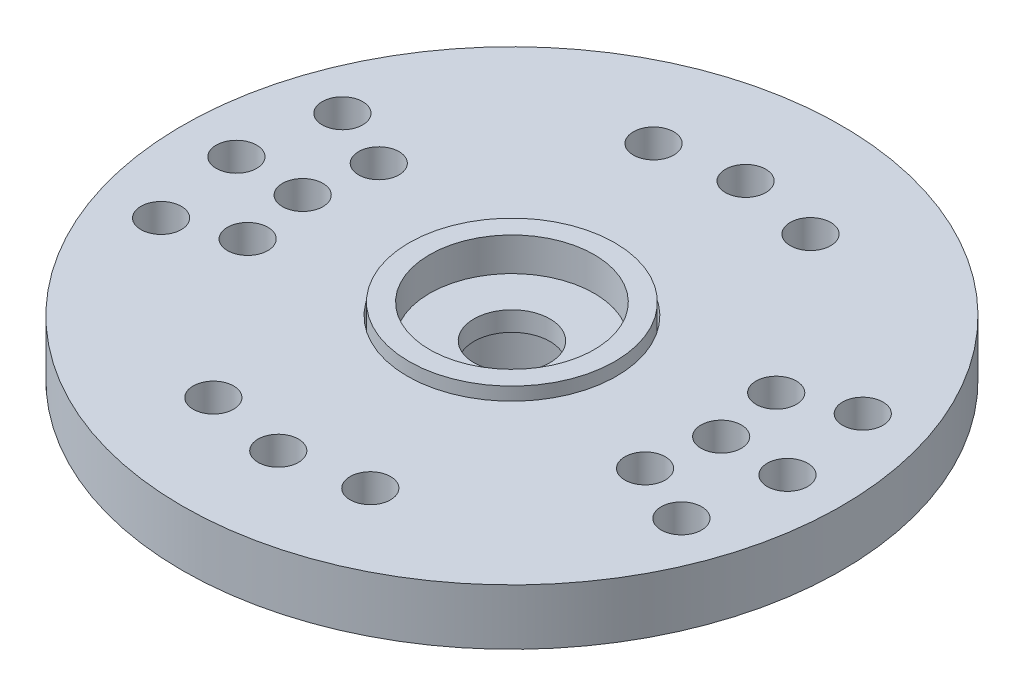
from build123d import *

# Parameters (mm, degrees)
SKETCH1_R           = 12.0015
SKETCH1_R_2         = 0.7366
SKETCH1_R_3         = 3.81
BOSS_EXTRUDE1_DEPTH = 2.032


with BuildPart() as part:
    # Sketch1 → Boss-Extrude1 (new body)
    with BuildSketch(Plane(origin=(0, 0, 0), x_dir=(1, 0, 0), z_dir=(0, 1, 0))):
        with Locations(Location((0, 0, 0), (0, 0, 270))):
            Circle(SKETCH1_R)
        with Locations(Location((0, 8.509, 0), (0, 0, 90))):
            Circle(SKETCH1_R_2, mode=Mode.SUBTRACT)
        with Locations(Location((0, -8.509, 0), (0, 0, 90))):
            Circle(SKETCH1_R_2, mode=Mode.SUBTRACT)
        with Locations(Location((7.62, 0, 0), (0, 0, 270))):
            Circle(SKETCH1_R_2, mode=Mode.SUBTRACT)
        with Locations(Location((-7.62, 0, 0), (0, 0, 90))):
            Circle(SKETCH1_R_2, mode=Mode.SUBTRACT)
        with Locations(Location((2.8575, -8.014847145, 0), (0, 0, 270))):
            Circle(SKETCH1_R_2, mode=Mode.SUBTRACT)
        with Locations(Location((2.8575, 8.014847145, 0), (0, 0, 270))):
            Circle(SKETCH1_R_2, mode=Mode.SUBTRACT)
        with Locations(Location((-2.8575, -8.014847145, 0), (0, 0, 90))):
            Circle(SKETCH1_R_2, mode=Mode.SUBTRACT)
        with Locations(Location((-2.8575, 8.014847145, 0), (0, 0, 90))):
            Circle(SKETCH1_R_2, mode=Mode.SUBTRACT)
        with Locations(Location((7.236281244, 2.3876, 0), (0, 0, 270))):
            Circle(SKETCH1_R_2, mode=Mode.SUBTRACT)
        with Locations(Location((7.236281244, -2.3876, 0), (0, 0, 270))):
            Circle(SKETCH1_R_2, mode=Mode.SUBTRACT)
        with Locations(Location((9.474063806, 3.302, 0), (0, 0, 270))):
            Circle(SKETCH1_R_2, mode=Mode.SUBTRACT)
        with Locations(Location((9.474063806, -3.302, 0), (0, 0, 270))):
            Circle(SKETCH1_R_2, mode=Mode.SUBTRACT)
        with Locations(Location((-7.236281244, -2.3876, 0), (0, 0, 90))):
            Circle(SKETCH1_R_2, mode=Mode.SUBTRACT)
        with Locations(Location((-9.474063806, -3.302, 0), (0, 0, 90))):
            Circle(SKETCH1_R_2, mode=Mode.SUBTRACT)
        with Locations(Location((-9.474063806, 3.302, 0), (0, 0, 90))):
            Circle(SKETCH1_R_2, mode=Mode.SUBTRACT)
        with Locations(Location((-7.236281244, 2.3876, 0), (0, 0, 90))):
            Circle(SKETCH1_R_2, mode=Mode.SUBTRACT)
        with Locations(Location((10.033, 0, 0), (0, 0, 270))):
            Circle(SKETCH1_R_2, mode=Mode.SUBTRACT)
        with Locations(Location((-10.033, 0, 0), (0, 0, 270))):
            Circle(SKETCH1_R_2, mode=Mode.SUBTRACT)
        with Locations(Location((0, 0, 0), (0, 0, 270))):
            Circle(SKETCH1_R_3, mode=Mode.SUBTRACT)
    extrude(amount=BOSS_EXTRUDE1_DEPTH)

    # Sketch3 → hub (revolve)
    with BuildSketch(Plane.XY, mode=Mode.PRIVATE) as hub_sk:
        Polygon((1.3843, 0.5334), (2.794, 0.5334), (2.794, -2.5146), (4.445, -2.5146), (4.445, 0), (3.7465, 0), (3.7465, 2.4638), (2.9972, 2.4638), (2.9972, 1.2446), (1.3843, 1.2446), align=None)
    revolve(hub_sk.sketch.rotate(Axis((0, 2.4638, 0), (0, -1, 0)), 180), axis=Axis((0, 2.4638, 0), (0, -1, 0)))


solid = part.part
